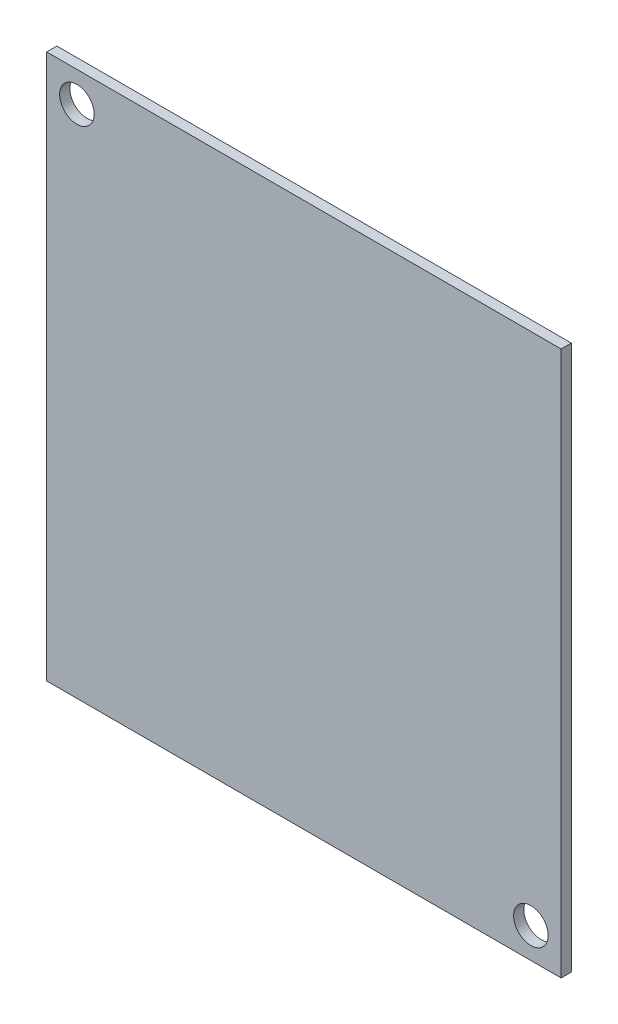
from build123d import *

# Parameters (mm, degrees)
SKETCH1_W           = 75.565
SKETCH1_H           = 80.01
SKETCH1_R           = 2.54
BOSS_EXTRUDE1_DEPTH = 1.5


with BuildPart() as part:
    # Sketch1 → Boss-Extrude1 (new body)
    with BuildSketch(Plane.XY):
        with Locations((37.7825, 40.005)):
            Rectangle(SKETCH1_W, SKETCH1_H)
        with Locations((4.445, 75.565)):
            Circle(SKETCH1_R, mode=Mode.SUBTRACT)
        with Locations((71.12, 4.445)):
            Circle(SKETCH1_R, mode=Mode.SUBTRACT)
    extrude(amount=BOSS_EXTRUDE1_DEPTH)


solid = part.part
